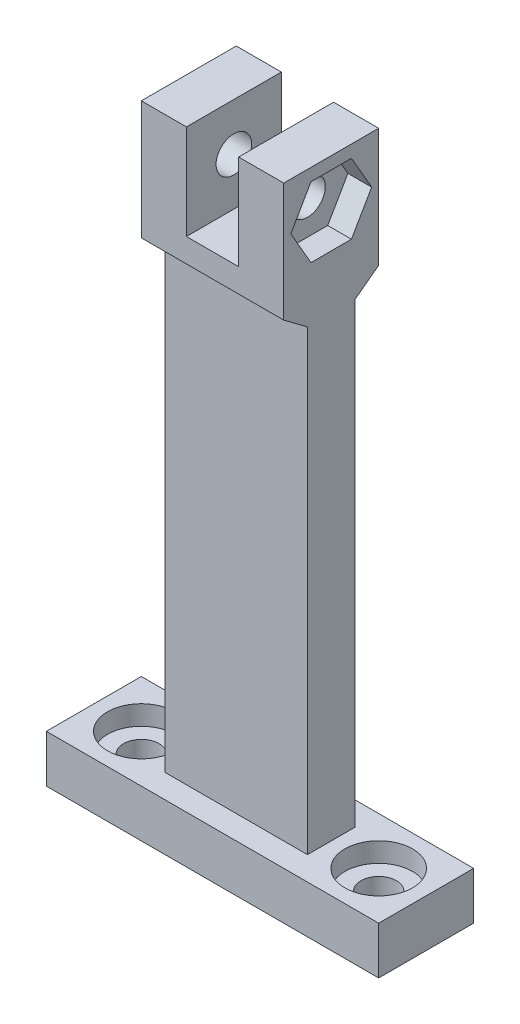
from build123d import *

# Parameters (mm, degrees)
CROQUIS1_W              = 28
CROQUIS1_H              = 8
CROQUIS1_R              = 2.85
CROQUIS1_R_2            = 1.5
SALIENTE_EXTRUIR1_DEPTH = 4
CORTAR_EXTRUIR1_START   = 2.35
CROQUIS1_3_R            = 2.85
CORTAR_EXTRUIR1_DEPTH   = 13.749668871
CROQUIS2_W              = 12
CROQUIS2_H              = 4
SALIENTE_EXTRUIR2_DEPTH = 40
CROQUIS3_W              = 12
CROQUIS3_H              = 8
SALIENTE_EXTRUIR3_DEPTH = 10
CROQUIS4_W              = 4.4
CROQUIS4_H              = 8
CORTAR_EXTRUIR2_DEPTH   = 57.356011214
CORTAR_EXTRUIR7_START   = -12
CROQUIS5_R              = 1.5
CORTAR_EXTRUIR7_DEPTH   = 12
CORTAR_EXTRUIR8_START   = -1.54
CROQUIS5_4_R            = 2.85
CROQUIS5_4_R_2          = 1.5
CORTAR_EXTRUIR8_DEPTH   = 1.54
CORTAR_EXTRUIR9_DEPTH   = 2
SALIENTE_EXTRUIR4_DEPTH = 12


with BuildPart() as part:
    # Croquis1 → Saliente-Extruir1 (new body)
    # profile 1 of 3: a face of its own
    with BuildSketch(Plane(origin=(0, 0, 0), x_dir=(1, 0, 0), z_dir=(0, 1, 0))):
        Rectangle(CROQUIS1_W, CROQUIS1_H)
        with Locations((-10, 0)):
            Circle(CROQUIS1_R, mode=Mode.SUBTRACT)
        with Locations((10, 0)):
            Circle(CROQUIS1_R, mode=Mode.SUBTRACT)
    # profile 2 of 3: a face of its own
    with BuildSketch(Plane(origin=(0, 0, 0), x_dir=(1, 0, 0), z_dir=(0, 1, 0))):
        with Locations((-10, 0)):
            Circle(CROQUIS1_R)
        with Locations(Location((-10, 0, 0), (0, 0, 270))):
            Circle(CROQUIS1_R_2, mode=Mode.SUBTRACT)
    # profile 3 of 3: a face of its own
    with BuildSketch(Plane(origin=(0, 0, 0), x_dir=(1, 0, 0), z_dir=(0, 1, 0))):
        with Locations((10, 0)):
            Circle(CROQUIS1_R)
        with Locations(Location((10, 0, 0), (0, 0, 270))):
            Circle(CROQUIS1_R_2, mode=Mode.SUBTRACT)
    extrude(amount=SALIENTE_EXTRUIR1_DEPTH)

    # Croquis1<3> → Cortar-Extruir1 (cut, through all)
    with BuildSketch(Plane(origin=(0, 0, 0), x_dir=(1, 0, 0), z_dir=(0, 1, 0)).offset(CORTAR_EXTRUIR1_START)):
        with Locations(Location((-10, 0, 0), (0, 0, 270))):
            Circle(CROQUIS1_3_R)
        with Locations(Location((10, 0, 0), (0, 0, 90))):
            Circle(CROQUIS1_3_R)
    extrude(amount=CORTAR_EXTRUIR1_DEPTH, mode=Mode.SUBTRACT)

    # Croquis2 → Saliente-Extruir2 (add)
    with BuildSketch(Plane(origin=(0, 4, 0), x_dir=(1, 0, 0), z_dir=(0, 1, 0))):
        Rectangle(CROQUIS2_W, CROQUIS2_H)
    extrude(amount=SALIENTE_EXTRUIR2_DEPTH)

    # Croquis3 → Saliente-Extruir3 (add)
    with BuildSketch(Plane(origin=(0, 44, 0), x_dir=(1, 0, 0), z_dir=(0, 1, 0))):
        Rectangle(CROQUIS3_W, CROQUIS3_H)
    extrude(amount=SALIENTE_EXTRUIR3_DEPTH)

    # Croquis4 → Cortar-Extruir2 (cut, through all)
    with BuildSketch(Plane.XY.offset(4)):
        with Locations((0, 50)):
            Rectangle(CROQUIS4_W, CROQUIS4_H)
    extrude(amount=-CORTAR_EXTRUIR2_DEPTH, mode=Mode.SUBTRACT)

    # Croquis5 → Cortar-Extruir7 (cut)
    with BuildSketch(Plane.ZY.offset(6).offset(CORTAR_EXTRUIR7_START)):
        with Locations((0, 50)):
            Circle(CROQUIS5_R)
    extrude(amount=CORTAR_EXTRUIR7_DEPTH, mode=Mode.SUBTRACT)

    # Croquis5<4> → Cortar-Extruir8 (cut)
    with BuildSketch(Plane.ZY.offset(6).offset(CORTAR_EXTRUIR8_START)):
        with Locations((0, 50)):
            Circle(CROQUIS5_4_R)
        with Locations((0, 50)):
            Circle(CROQUIS5_4_R_2, mode=Mode.SUBTRACT)
    extrude(amount=CORTAR_EXTRUIR8_DEPTH, mode=Mode.SUBTRACT)

    # Croquis7 → Cortar-Extruir9 (cut)
    with BuildSketch(Plane(origin=(6, 0, 0), x_dir=(0, 0, -1), z_dir=(1, 0, 0))):
        Polygon((-3.406366588, 50), (-1.703183294, 47.05), (1.703183294, 47.05), (3.406366588, 50), (1.703183294, 52.95), (-1.703183294, 52.95), align=None)
    extrude(amount=-CORTAR_EXTRUIR9_DEPTH, mode=Mode.SUBTRACT)

    # Croquis8 → Saliente-Extruir4 (add)
    with BuildSketch(Plane(origin=(6, 0, 0), x_dir=(0, 0, -1), z_dir=(1, 0, 0))):
        Polygon((-4, 44), (-2, 44), (-2, 42.5), align=None)
        Polygon((2, 42.5), (4, 44), (2, 44), align=None)
    extrude(amount=-SALIENTE_EXTRUIR4_DEPTH)


solid = part.part
